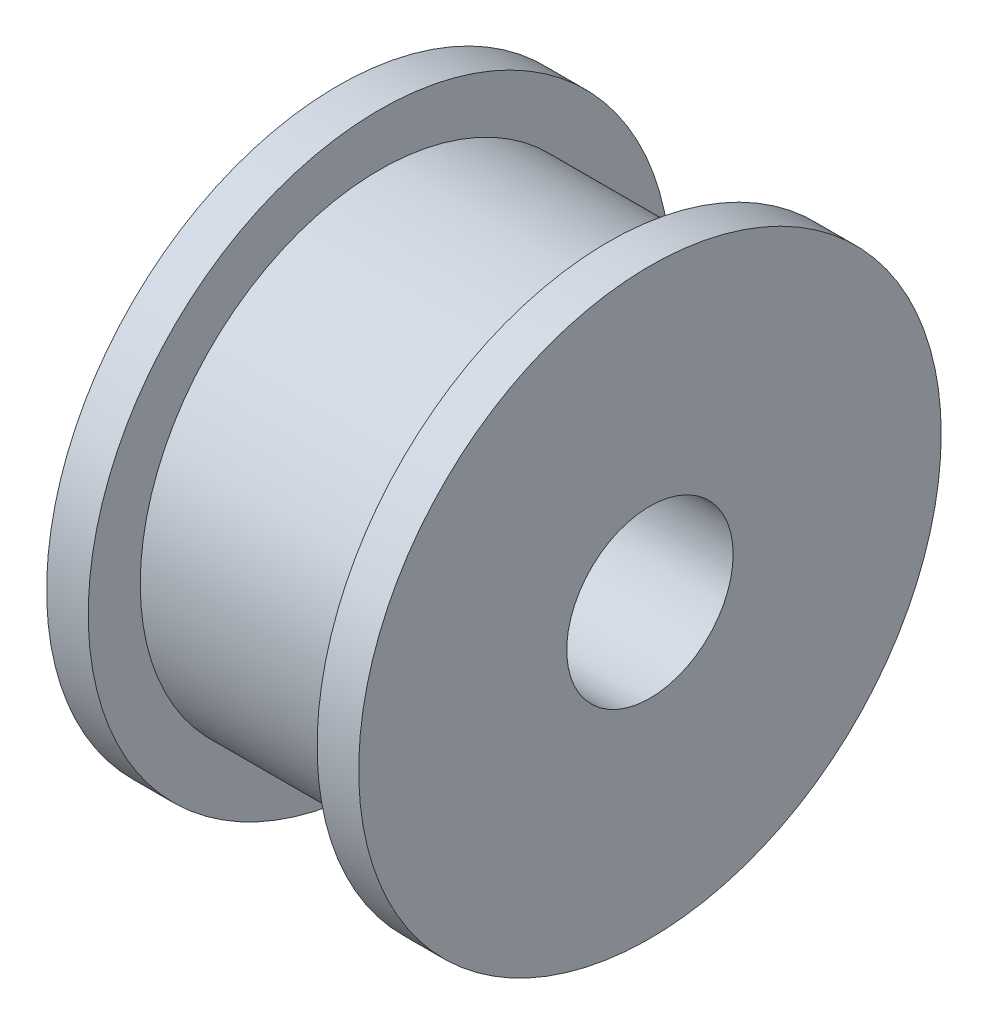
from build123d import *

# Parameters (mm, degrees)
SKETCH1_R           = 14
SKETCH1_R_2         = 4
BOSS_EXTRUDE1_DEPTH = 7.5
SKETCH2_OUTSIDE_W   = 38.468
SKETCH2_OUTSIDE_H   = 38.468
SKETCH2_OUTSIDE_R   = 11.5
CUT_EXTRUDE1_DEPTH  = 5.5


with BuildPart() as part:
    # Sketch1 → Boss-Extrude1 (new, symmetric)
    with BuildSketch(Plane(origin=(0, 0, 0), x_dir=(0, 0, -1), z_dir=(1, 0, 0))):
        Circle(SKETCH1_R)
        Circle(SKETCH1_R_2, mode=Mode.SUBTRACT)
    extrude(amount=BOSS_EXTRUDE1_DEPTH, both=True)

    # Sketch2 outside → Cut-Extrude1 (cut, symmetric)
    with BuildSketch(Plane(origin=(0, 0, 0), x_dir=(0, 0, -1), z_dir=(1, 0, 0))):
        Rectangle(SKETCH2_OUTSIDE_W, SKETCH2_OUTSIDE_H)
        Circle(SKETCH2_OUTSIDE_R, mode=Mode.SUBTRACT)
    extrude(amount=CUT_EXTRUDE1_DEPTH, both=True, mode=Mode.SUBTRACT)


solid = part.part
